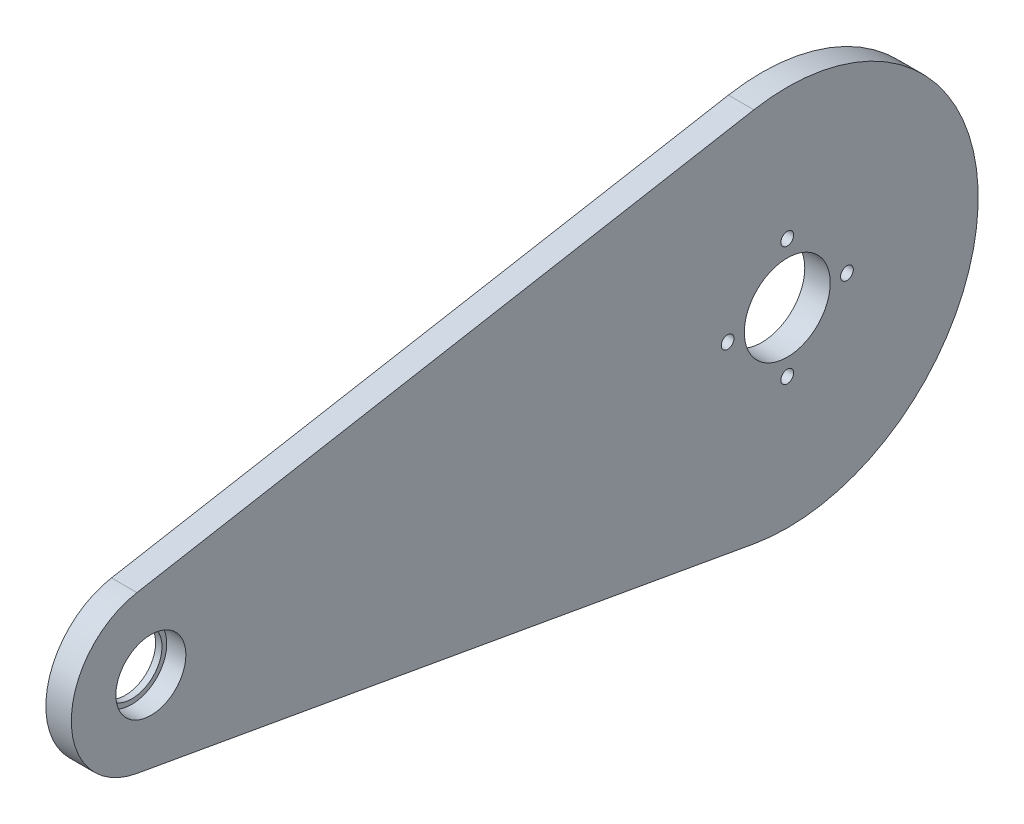
from build123d import *

# Parameters (mm, degrees)
SKETCH1_R           = 13.5
SKETCH1_R_2         = 11
BOSS_EXTRUDE1_DEPTH = 4
SKETCH2_R           = 2
CUT_EXTRUDE1_DEPTH  = 234
SKETCH3_R           = 11
SKETCH3_R_2         = 9.5
BOSS_EXTRUDE3_DEPTH = 2


with BuildPart() as part:
    # Sketch1 → Boss-Extrude1 (new, symmetric)
    with BuildSketch(Plane(origin=(0, 0, 0), x_dir=(0, 0, -1), z_dir=(1, 0, 0))):
        with BuildLine():
            Line((-204.375, 24.614210834), (-10.5, 59.074106003))
            ThreePointArc((-10.5, 59.074106003), (60, 0), (-10.5, -59.074106003))
            Line((-10.5, -59.074106003), (-204.375, -24.614210834))
            ThreePointArc((-204.375, -24.614210834), (-225, 0), (-204.375, 24.614210834))
        make_face()
        Circle(SKETCH1_R, mode=Mode.SUBTRACT)
        with Locations((-200, 0)):
            Circle(SKETCH1_R_2, mode=Mode.SUBTRACT)
    extrude(amount=BOSS_EXTRUDE1_DEPTH, both=True)

    # Sketch2 → Cut-Extrude1 (cut, through all)
    with BuildSketch(Plane(origin=(4, 0, 0), x_dir=(0, 0, -1), z_dir=(1, 0, 0))):
        with Locations((0, 18.75)):
            Circle(SKETCH2_R)
        with Locations((18.75, 0)):
            Circle(SKETCH2_R)
        with Locations((0, -18.75)):
            Circle(SKETCH2_R)
        with Locations((-18.75, 0)):
            Circle(SKETCH2_R)
    extrude(amount=-CUT_EXTRUDE1_DEPTH, mode=Mode.SUBTRACT)

    # Sketch3 → Boss-Extrude3 (add)
    with BuildSketch(Plane.ZY.offset(4)):
        with Locations((200, 0)):
            Circle(SKETCH3_R)
        with Locations((200, 0)):
            Circle(SKETCH3_R_2, mode=Mode.SUBTRACT)
    extrude(amount=-BOSS_EXTRUDE3_DEPTH)


solid = part.part
